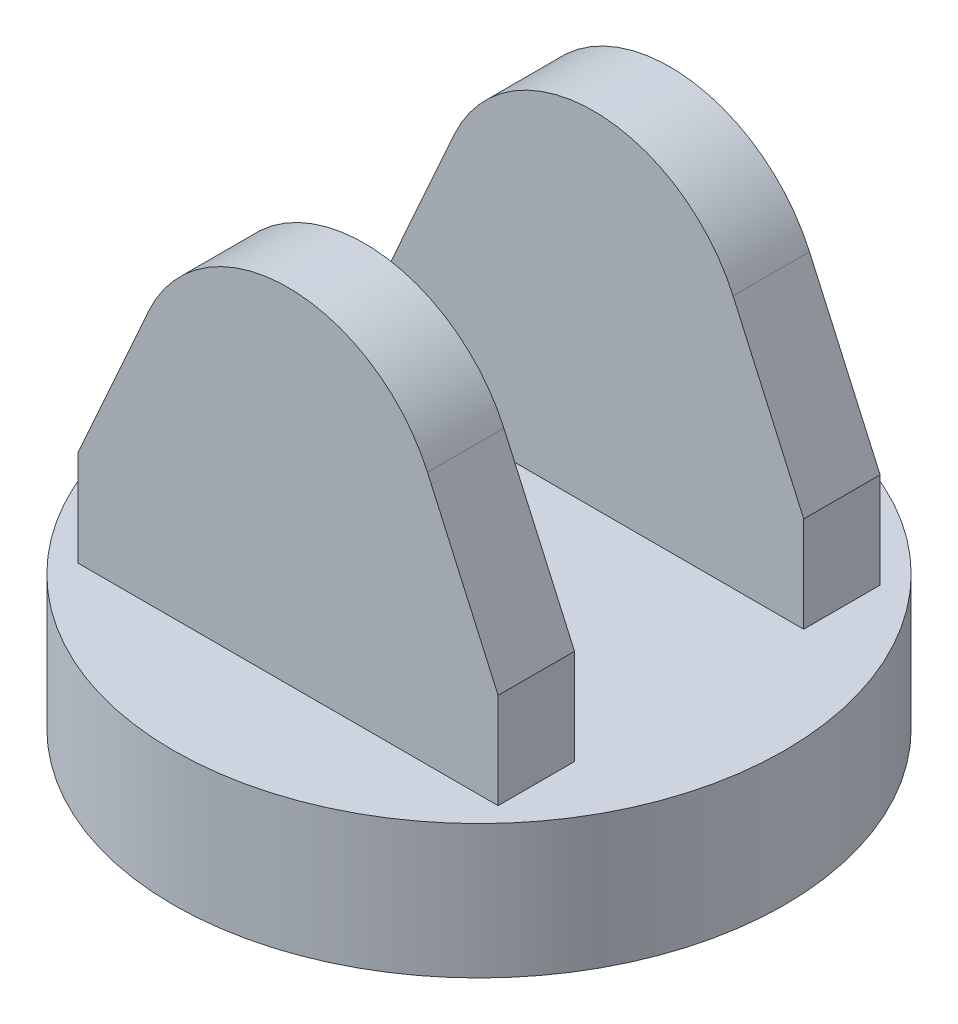
from build123d import *

# Parameters (mm, degrees)
CROQUIS1_W              = 15
CROQUIS1_H              = 50
CROQUIS1_W_2            = 50
CROQUIS1_H_2            = 115
SALIENTE_EXTRUIR1_DEPTH = 250
CROQUIS2_R              = 80
SALIENTE_EXTRUIR2_DEPTH = 35
SALIENTE_EXTRUIR3_DEPTH = 50
CROQUIS4_W              = 60
CROQUIS4_H              = 90
CORTAR_EXTRUIR1_DEPTH   = 407.509532484
CROQUIS5_R              = 80
CORTAR_EXTRUIR2_DEPTH   = 283.710098865


with BuildPart() as part:
    # Croquis1 → Saliente-Extruir1 (new body)
    with BuildSketch(Plane(origin=(0, 0, 0), x_dir=(1, 0, 0), z_dir=(0, 1, 0))):
        with Locations((-32.5, 0)):
            Rectangle(CROQUIS1_W, CROQUIS1_H)
        Rectangle(CROQUIS1_W_2, CROQUIS1_H_2)
    extrude(amount=SALIENTE_EXTRUIR1_DEPTH)

    # Croquis2 → Saliente-Extruir2 (add)
    with BuildSketch(Plane(origin=(0, 250, 0), x_dir=(1, 0, 0), z_dir=(0, 1, 0))):
        with Locations(Location((-25, 0, 0), (0, 0, 270))):
            Circle(CROQUIS2_R)
    extrude(amount=SALIENTE_EXTRUIR2_DEPTH)

    # Croquis3 → Saliente-Extruir3 (add, symmetric)
    with BuildSketch(Plane.XY):
        with BuildLine():
            Line((11.514226217, 351.331297677), (30, 310))
            Line((30, 310), (30, 285))
            Line((30, 285), (-80, 285))
            Line((-80, 285), (-80, 310))
            Line((-80, 310), (-61.514226217, 351.331297677))
            ThreePointArc((-61.514226217, 351.331297677), (-25, 375), (11.514226217, 351.331297677))
        make_face()
    extrude(amount=SALIENTE_EXTRUIR3_DEPTH, both=True)

    # Croquis4 → Cortar-Extruir1 (cut, through all)
    with BuildSketch(Plane(origin=(30, 0, 0), x_dir=(0, 0, -1), z_dir=(1, 0, 0))):
        with Locations((0, 330)):
            Rectangle(CROQUIS4_W, CROQUIS4_H)
    extrude(amount=-CORTAR_EXTRUIR1_DEPTH, mode=Mode.SUBTRACT)

    # Croquis5 → Cortar-Extruir2 (cut, through all)
    with BuildSketch(Plane.XZ.offset(-250)):
        with Locations(Location((-25, 0, 0), (0, 0, 90))):
            Circle(CROQUIS5_R)
    extrude(amount=CORTAR_EXTRUIR2_DEPTH, mode=Mode.SUBTRACT)


solid = part.part
